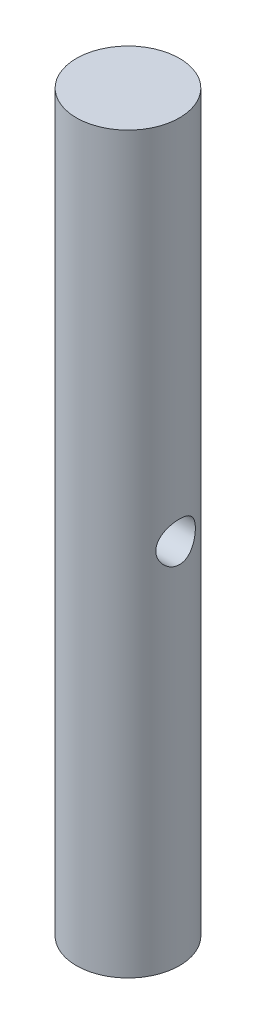
from build123d import *

# Parameters (mm, degrees)
SKETCH1_R               = 4.5625
BOSS_EXTRUDE1_DEPTH     = 65
CUT_EXTRUDE1_DEPTH      = 66.319467332
CUT_EXTRUDE1_DEPTH_BACK = 66.319467332
SKETCH2_R               = 1.75
CUT_EXTRUDE2_DEPTH      = 23.5


with BuildPart() as part:
    # Sketch1 → Boss-Extrude1 (new body)
    with BuildSketch(Plane(origin=(0, 0, 0), x_dir=(1, 0, 0), z_dir=(0, 1, 0))):
        with Locations(Location((0, 0, 0), (0, 0, 270))):
            Circle(SKETCH1_R)
    extrude(amount=BOSS_EXTRUDE1_DEPTH)

    # Sketch2 → Cut-Extrude1 (cut, two sides: drawn at the far end of the back side and taken through both)
    with BuildSketch(Plane(origin=(0, 0, 0), x_dir=(0, 0, -1), z_dir=(1, 0, 0)).offset(-CUT_EXTRUDE1_DEPTH_BACK)):
        with Locations((0, 32.5)):
            Circle(SKETCH2_R)
    extrude(amount=CUT_EXTRUDE1_DEPTH + CUT_EXTRUDE1_DEPTH_BACK, mode=Mode.SUBTRACT)

    # Sketch4 → Cut-Extrude2 (cut)
    with BuildSketch(Plane(origin=(0, 0, 0), x_dir=(-1, 0, 0), z_dir=(0, -1, 0))):
        with BuildLine():
            Line((-2.455890877, -2.315), (-2.455890877, 2.315))
            ThreePointArc((-2.455890877, 2.315), (3.375, 0), (-2.455890877, -2.315))
        make_face()
    extrude(amount=-CUT_EXTRUDE2_DEPTH, mode=Mode.SUBTRACT)


solid = part.part
